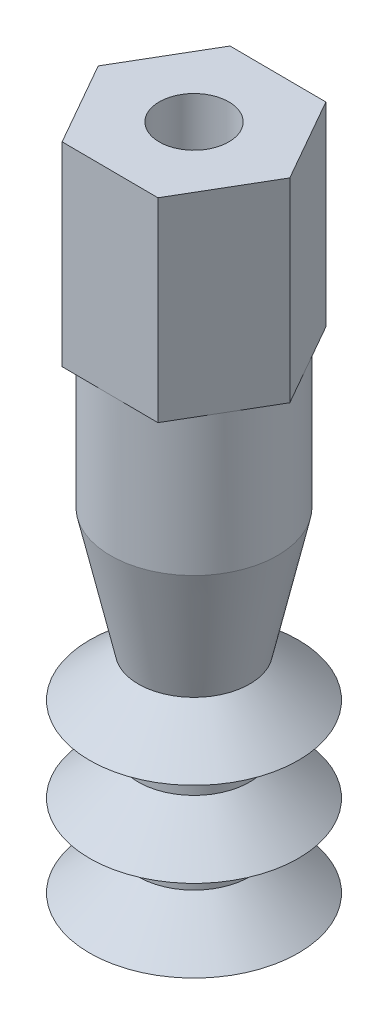
from build123d import *

# Parameters (mm, degrees)
COQUE_T       = -0.9
BOSSAGE_DEPTH = 14
ESQUISSE3_R   = 2.5
ENLEV_DEPTH   = 50.157908825


with BuildPart() as part:
    # esquisse → revolution (revolve)
    with BuildSketch(Plane.XY, mode=Mode.PRIVATE) as revolution_sk:
        Polygon((0, 0), (7.5, 0), (4, 3), (4, 5.897032863), (7.5, 5.897032863), (4, 8.897032863), (4, 12), (7.5, 12), (4, 15), (6, 24), (6, 34), (0, 34), align=None)
    revolve(revolution_sk.sketch.rotate(Axis((0, 34, 0), (0, -1, 0)), 180), axis=Axis((0, 34, 0), (0, -1, 0)))

    # coque
    coque_openings = [part.faces().sort_by_distance(p)[0] for p in [
        (0, 0, 0),
    ]]
    offset(amount=COQUE_T, openings=coque_openings, kind=Kind.INTERSECTION)

    # Esboço2 → bossage (add)
    with BuildSketch(Plane(origin=(0, 34, 0), x_dir=(1, 0, 0), z_dir=(0, 1, 0))):
        Polygon((3.499984176, 5.979139634), (-3.428094728, 6.020645027), (-6.928078904, 0.041505392), (-3.499984176, -5.979139634), (3.428094728, -6.020645027), (6.928078904, -0.041505392), align=None)
    extrude(amount=BOSSAGE_DEPTH)

    # esquisse3 → enlev (cut, through all)
    with BuildSketch(Plane(origin=(0, 48, 0), x_dir=(1, 0, 0), z_dir=(0, 1, 0))):
        with Locations(Location((0, 0, 0), (0, 0, 270))):
            Circle(ESQUISSE3_R)
    extrude(amount=-ENLEV_DEPTH, mode=Mode.SUBTRACT)


solid = part.part
